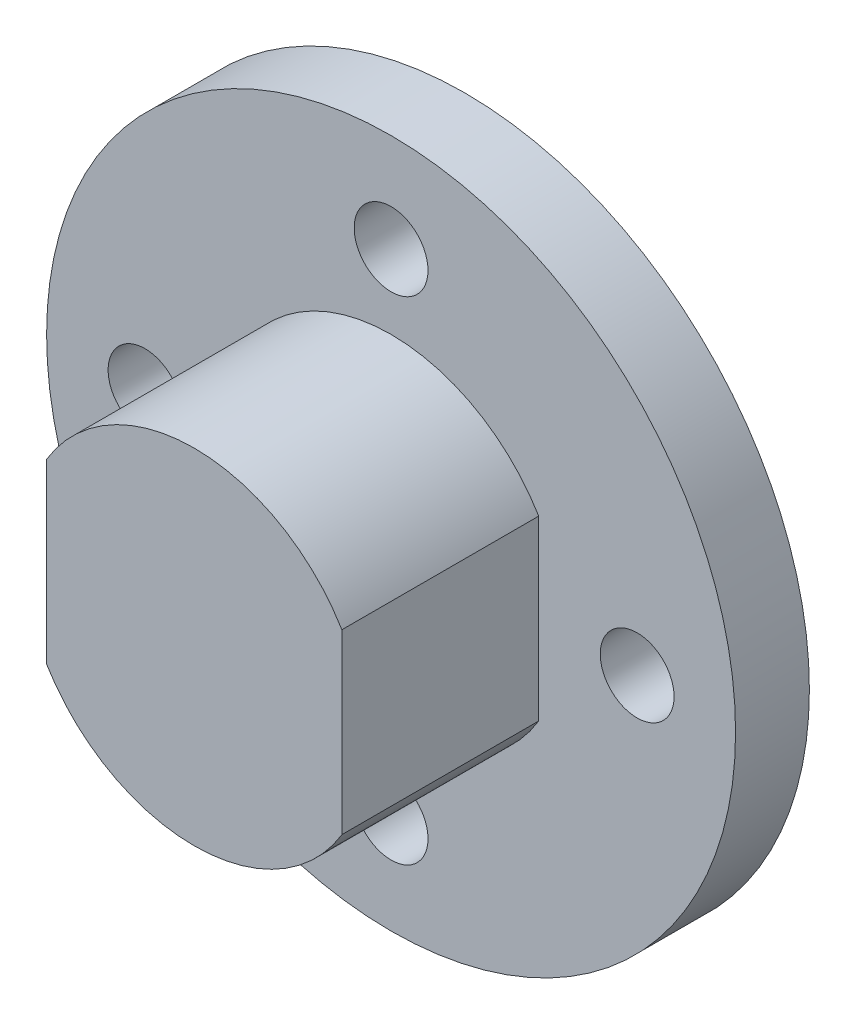
from build123d import *

# Parameters (mm, degrees)
SKETCH_1_R      = 14
SKETCH_1_R_2    = 1.5
EXTRUDE_1_DEPTH = 3
EXTRUDE_2_DEPTH = 8


with BuildPart() as part:
    # 草图1 → 凸台-拉伸1 (new body)
    with BuildSketch(Plane.XY):
        Circle(SKETCH_1_R)
        with Locations((0, 10)):
            Circle(SKETCH_1_R_2, mode=Mode.SUBTRACT)
        with Locations((10, 0)):
            Circle(SKETCH_1_R_2, mode=Mode.SUBTRACT)
        with Locations((0, -10)):
            Circle(SKETCH_1_R_2, mode=Mode.SUBTRACT)
        with Locations((-10, 0)):
            Circle(SKETCH_1_R_2, mode=Mode.SUBTRACT)
    extrude(amount=EXTRUDE_1_DEPTH)

    # 草图3 → 凸台-拉伸2 (add)
    with BuildSketch(Plane.XY.offset(3)):
        with BuildLine():
            Line((6, 3.605551275), (6, -3.605551275))
            ThreePointArc((6, -3.605551275), (0, -7), (-6, -3.605551275))
            Line((-6, -3.605551275), (-6, 3.605551275))
            ThreePointArc((-6, 3.605551275), (0, 7), (6, 3.605551275))
        make_face()
    extrude(amount=EXTRUDE_2_DEPTH)


solid = part.part
